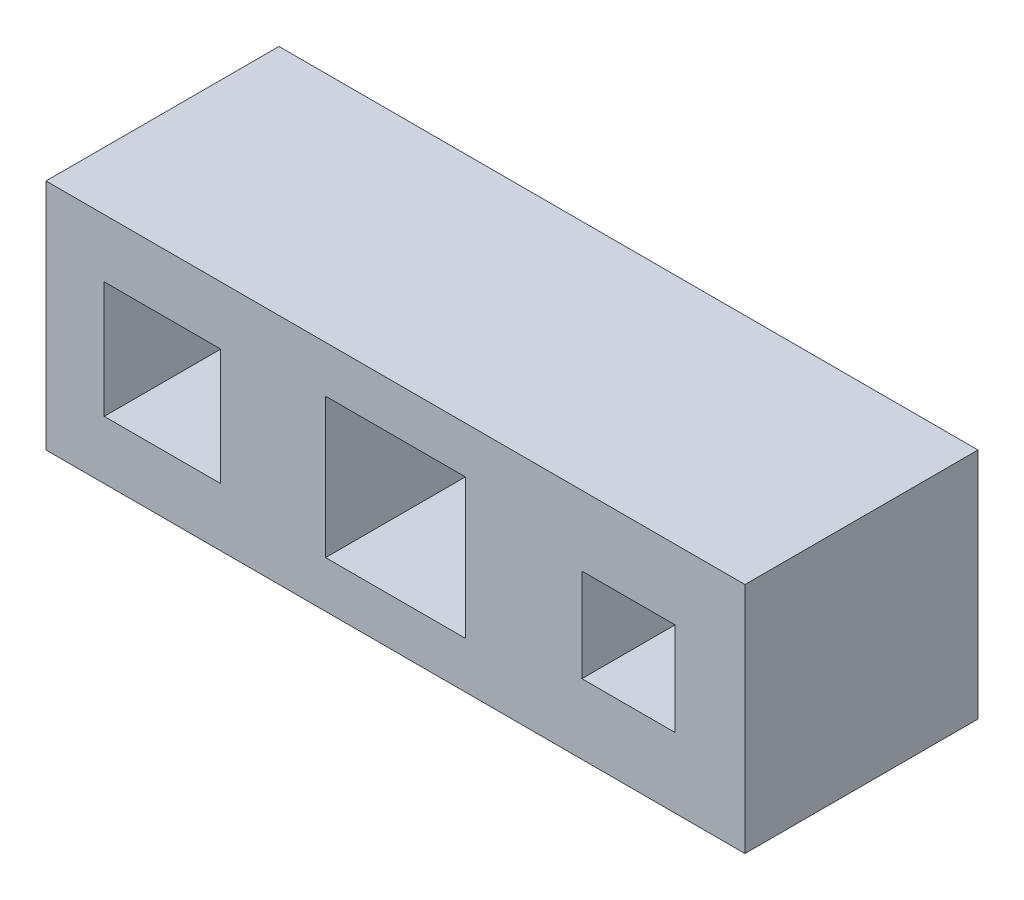
from build123d import *

# Parameters (mm, degrees)
SKETCH1_W           = 2.5
SKETCH1_H           = 2.5
SKETCH1_W_2         = 2
SKETCH1_H_2         = 2
SKETCH1_W_3         = 3
SKETCH1_H_3         = 3
BOSS_EXTRUDE1_DEPTH = 5


with BuildPart() as part:
    # Sketch1 → Boss-Extrude1 (new body)
    with BuildSketch(Plane.XY):
        Polygon((0, 0), (5, 0), (15, 0), (15, 5), (5, 5), (0, 5), align=None)
        with Locations((2.5, 2.5)):
            Rectangle(SKETCH1_W, SKETCH1_H, mode=Mode.SUBTRACT)
        with Locations((12.5, 2.5)):
            Rectangle(SKETCH1_W_2, SKETCH1_H_2, mode=Mode.SUBTRACT)
        with Locations((7.5, 2.5)):
            Rectangle(SKETCH1_W_3, SKETCH1_H_3, mode=Mode.SUBTRACT)
    extrude(amount=BOSS_EXTRUDE1_DEPTH)


solid = part.part
